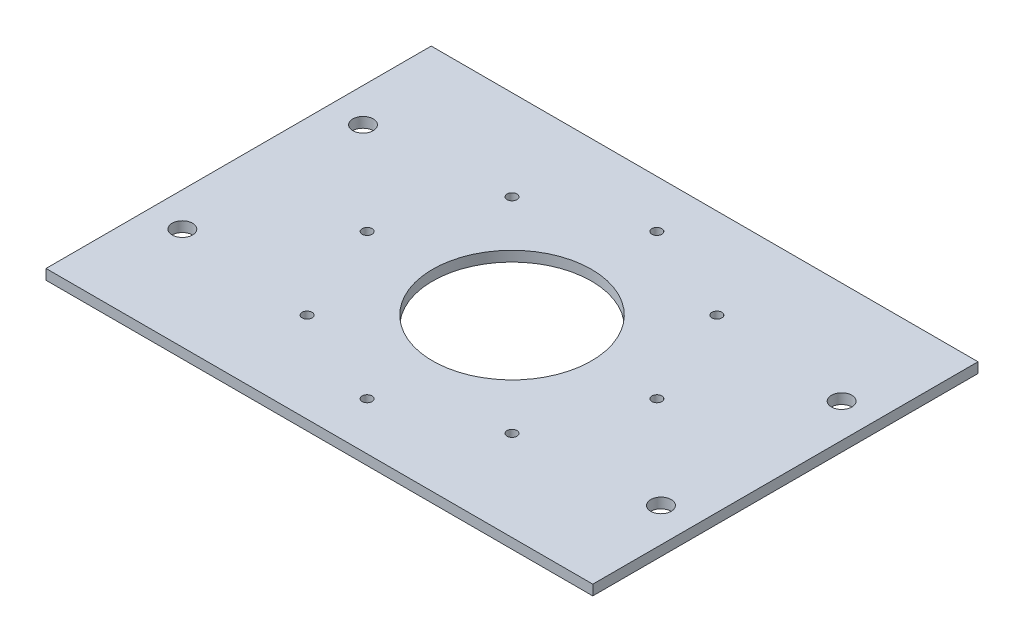
from build123d import *

# Parameters (mm, degrees)
SKETCH_1_W          = 160.4
SKETCH_1_H          = 113
EXTRUDE_1_DEPTH     = 3
SKETCH_2_R          = 1.45
CUT_EXTRUDE_1_DEPTH = 3
SKETCH_3_R          = 23.297499696
CUT_EXTRUDE_2_DEPTH = 3
SKETCH_4_R          = 3
CUT_EXTRUDE_3_DEPTH = 3


with BuildPart() as part:
    # 草图1 → 凸台-拉伸1 (new body)
    with BuildSketch(Plane(origin=(0, 0, 0), x_dir=(1, 0, 0), z_dir=(0, 1, 0))):
        Rectangle(SKETCH_1_W, SKETCH_1_H)
    extrude(amount=EXTRUDE_1_DEPTH)

    # 草图2 → 切除-拉伸1 (cut)
    with BuildSketch(Plane(origin=(0, 3, 0), x_dir=(1, 0, 0), z_dir=(0, 1, 0))):
        with Locations(Location((0, -42.5, 0), (0, 0, 270))):
            Circle(SKETCH_2_R)
        with Locations(Location((-30.0520382, -30.0520382, 0), (0, 0, 270))):
            Circle(SKETCH_2_R)
        with Locations(Location((-42.5, 0, 0), (0, 0, 270))):
            Circle(SKETCH_2_R)
        with Locations(Location((-30.0520382, 30.0520382, 0), (0, 0, 270))):
            Circle(SKETCH_2_R)
        with Locations(Location((0, 42.5, 0), (0, 0, 270))):
            Circle(SKETCH_2_R)
        with Locations(Location((30.0520382, 30.0520382, 0), (0, 0, 270))):
            Circle(SKETCH_2_R)
        with Locations(Location((42.5, 0, 0), (0, 0, 270))):
            Circle(SKETCH_2_R)
        with Locations(Location((30.0520382, -30.0520382, 0), (0, 0, 270))):
            Circle(SKETCH_2_R)
    extrude(amount=-CUT_EXTRUDE_1_DEPTH, mode=Mode.SUBTRACT)

    # 草图3 → 切除-拉伸2 (cut)
    with BuildSketch(Plane.XZ):
        with Locations(Location((0, 0, 0), (0, 0, 270))):
            Circle(SKETCH_3_R)
    extrude(amount=-CUT_EXTRUDE_2_DEPTH, mode=Mode.SUBTRACT)

    # 草图4 → 切除-拉伸3 (cut)
    with BuildSketch(Plane(origin=(0, 3, 0), x_dir=(1, 0, 0), z_dir=(0, 1, 0))):
        with Locations(Location((70.198513237, -26.5, 0), (0, 0, 270))):
            Circle(SKETCH_4_R)
        with Locations(Location((-70.2, -26.5, 0), (0, 0, 270))):
            Circle(SKETCH_4_R)
        with Locations(Location((70.198513237, 26.5, 0), (0, 0, 270))):
            Circle(SKETCH_4_R)
        with Locations(Location((-70.2, 26.5, 0), (0, 0, 270))):
            Circle(SKETCH_4_R)
    extrude(amount=-CUT_EXTRUDE_3_DEPTH, mode=Mode.SUBTRACT)


solid = part.part
